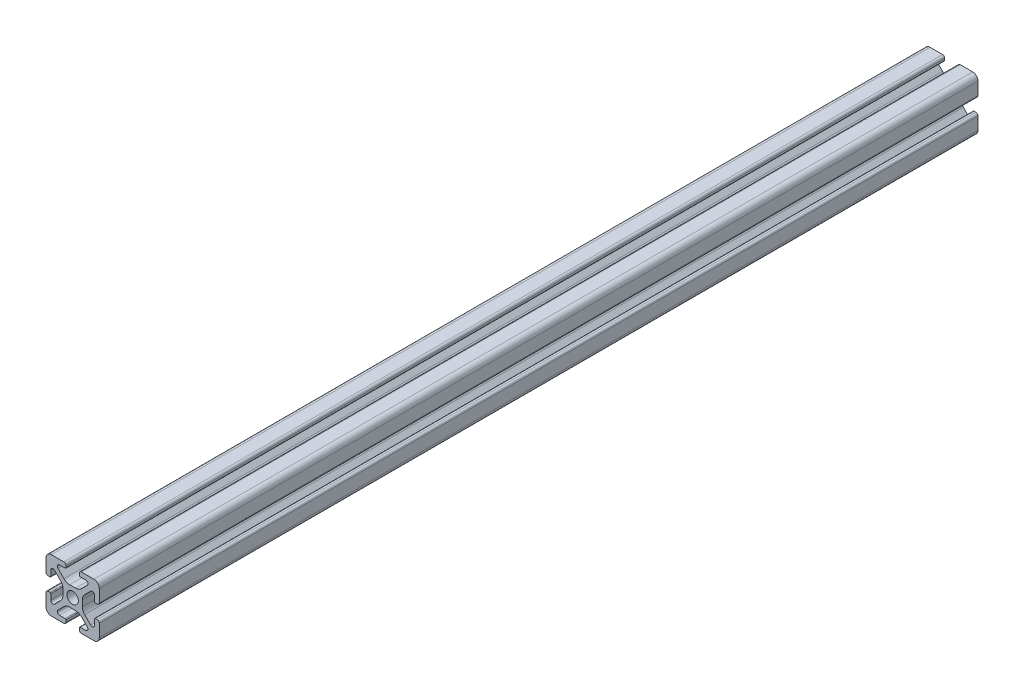
from build123d import *

# Parameters (mm, degrees)
ESQUISSE1_R        = 2.15
BOSS_EXTRU_1_DEPTH = 330


with BuildPart() as part:
    # Esquisse1 → Boss.-Extru.1 (new body)
    with BuildSketch(Plane(origin=(0, 0, 0), x_dir=(-1, 0, 0), z_dir=(0, 0, -1))):
        with BuildLine():
            Line((-12.499999997, 0.800000003), (-12.499999998, 1.500000003))
            ThreePointArc((-12.499999998, 1.500000003), (-12.587867964, 1.712132039), (-12.8, 1.800000005))
            Line((-12.8, 1.800000005), (-14.9175884, 1.800000005))
            ThreePointArc((-14.9175884, 1.800000005), (-15.686636444, 2.31386148), (-15.50619229, 3.2210155))
            Line((-15.50619229, 3.2210155), (-13.25588745, 5.47132034))
            ThreePointArc((-13.25588745, 5.47132034), (-12.282617404, 6.121638593), (-11.134567108, 6.349999996))
            Line((-11.134567108, 6.349999996), (-8.865432907, 6.349999996))
            ThreePointArc((-8.865432907, 6.349999996), (-7.717382611, 6.121638594), (-6.744112567, 5.471320341))
            Line((-6.744112567, 5.471320341), (-4.493807729, 3.221015503))
            ThreePointArc((-4.493807729, 3.221015503), (-4.313363575, 2.313861481), (-5.082411621, 1.800000005))
            Line((-5.082411621, 1.800000005), (-7.20000001, 1.800000005))
            ThreePointArc((-7.20000001, 1.800000005), (-7.412132045, 1.71213204), (-7.50000001, 1.500000005))
            Line((-7.50000001, 1.500000005), (-7.50000001, 0.8))
            ThreePointArc((-7.50000001, 0.8), (-7.265685435, 0.234314575), (-6.70000001, 0))
            Line((-6.70000001, 0), (-2, 0))
            ThreePointArc((-2, 0), (-0.585786438, 0.585786438), (0, 2))
            Line((0, 2), (0, 6.699999998))
            ThreePointArc((0, 6.699999998), (-0.234314576, 7.265685424), (-0.800000003, 7.5))
            Line((-0.800000003, 7.5), (-1.50000001, 7.5))
            ThreePointArc((-1.50000001, 7.5), (-1.712132046, 7.412132033), (-1.800000013, 7.199999997))
            Line((-1.800000013, 7.199999997), (-1.800000013, 5.082411603))
            ThreePointArc((-1.800000013, 5.082411603), (-2.313861487, 4.31336356), (-3.221015507, 4.493807713))
            Line((-3.221015507, 4.493807713), (-5.471320347, 6.744112553))
            ThreePointArc((-5.471320347, 6.744112553), (-6.1216386, 7.717382599), (-6.350000003, 8.865432896))
            Line((-6.350000003, 8.865432896), (-6.350000003, 11.134567102))
            ThreePointArc((-6.350000003, 11.134567102), (-6.121638601, 12.282617397), (-5.471320348, 13.255887442))
            Line((-5.471320348, 13.255887442), (-3.221015512, 15.506192278))
            ThreePointArc((-3.221015512, 15.506192278), (-2.313861489, 15.686636432), (-1.800000013, 14.917588386))
            Line((-1.800000013, 14.917588386), (-1.800000013, 12.799999998))
            ThreePointArc((-1.800000013, 12.799999998), (-1.712132047, 12.587867963), (-1.500000013, 12.499999997))
            Line((-1.500000013, 12.499999997), (-0.8, 12.499999997))
            ThreePointArc((-0.8, 12.499999997), (-0.234314575, 12.734314573), (0, 13.299999998))
            Line((0, 13.299999998), (0, 18))
            ThreePointArc((0, 18), (-0.585786438, 19.414213562), (-2, 20))
            Line((-2, 20), (-6.700000008, 20))
            ThreePointArc((-6.700000008, 20), (-7.265685435, 19.765685424), (-7.50000001, 19.199999998))
            Line((-7.50000001, 19.199999998), (-7.50000001, 18.500000005))
            ThreePointArc((-7.50000001, 18.500000005), (-7.412132044, 18.287867969), (-7.200000008, 18.200000003))
            Line((-7.200000008, 18.200000003), (-5.082411594, 18.200000003))
            ThreePointArc((-5.082411594, 18.200000003), (-4.313363546, 17.686138526), (-4.493807701, 16.778984501))
            Line((-4.493807701, 16.778984501), (-6.744112542, 14.528679659))
            ThreePointArc((-6.744112542, 14.528679659), (-7.717382588, 13.878361406), (-8.865432885, 13.650000003))
            Line((-8.865432885, 13.650000003), (-11.134567112, 13.650000003))
            ThreePointArc((-11.134567112, 13.650000003), (-12.282617407, 13.878361405), (-13.255887452, 14.528679658))
            Line((-13.255887452, 14.528679658), (-15.506192292, 16.778984498))
            ThreePointArc((-15.506192292, 16.778984498), (-15.686636447, 17.686138525), (-14.917588397, 18.200000002))
            Line((-14.917588397, 18.200000002), (-12.799999998, 18.200000003))
            ThreePointArc((-12.799999998, 18.200000003), (-12.587867963, 18.287867968), (-12.499999997, 18.500000002))
            Line((-12.499999997, 18.500000002), (-12.499999997, 19.2))
            ThreePointArc((-12.499999997, 19.2), (-12.734314573, 19.765685425), (-13.299999998, 20))
            Line((-13.299999998, 20), (-18, 20))
            ThreePointArc((-18, 20), (-19.414213562, 19.414213562), (-20, 18))
            Line((-20, 18), (-20, 13.3))
            ThreePointArc((-20, 13.3), (-19.765685424, 12.734314573), (-19.199999998, 12.499999997))
            Line((-19.199999998, 12.499999997), (-18.500000003, 12.499999997))
            ThreePointArc((-18.500000003, 12.499999997), (-18.287867967, 12.587867964), (-18.2, 12.8))
            Line((-18.2, 12.8), (-18.2, 14.91758839))
            ThreePointArc((-18.2, 14.91758839), (-17.686138526, 15.686636434), (-16.778984506, 15.50619228))
            Line((-16.778984506, 15.50619228), (-14.528679657, 13.255887431))
            ThreePointArc((-14.528679657, 13.255887431), (-13.878361403, 12.282617385), (-13.650000001, 11.134567088))
            Line((-13.650000001, 11.134567088), (-13.650000001, 8.865432886))
            ThreePointArc((-13.650000001, 8.865432886), (-13.878361403, 7.717382591), (-14.528679656, 6.744112546))
            Line((-14.528679656, 6.744112546), (-16.778984496, 4.493807706))
            ThreePointArc((-16.778984496, 4.493807706), (-17.686138522, 4.313363551), (-18.2, 5.0824116))
            Line((-18.2, 5.0824116), (-18.2, 7.2))
            ThreePointArc((-18.2, 7.2), (-18.287867966, 7.412132034), (-18.5, 7.5))
            Line((-18.5, 7.5), (-19.2, 7.5))
            ThreePointArc((-19.2, 7.5), (-19.765685425, 7.265685425), (-20, 6.7))
            Line((-20, 6.7), (-20, 2))
            ThreePointArc((-20, 2), (-19.414213562, 0.585786438), (-18, 0))
            Line((-18, 0), (-13.3, 0))
            ThreePointArc((-13.3, 0), (-12.734314573, 0.234314576), (-12.499999997, 0.800000003))
        make_face()
        with Locations(Location((-10, 10, 0), (0, 0, 180))):
            Circle(ESQUISSE1_R, mode=Mode.SUBTRACT)
    extrude(amount=-BOSS_EXTRU_1_DEPTH)


solid = part.part
